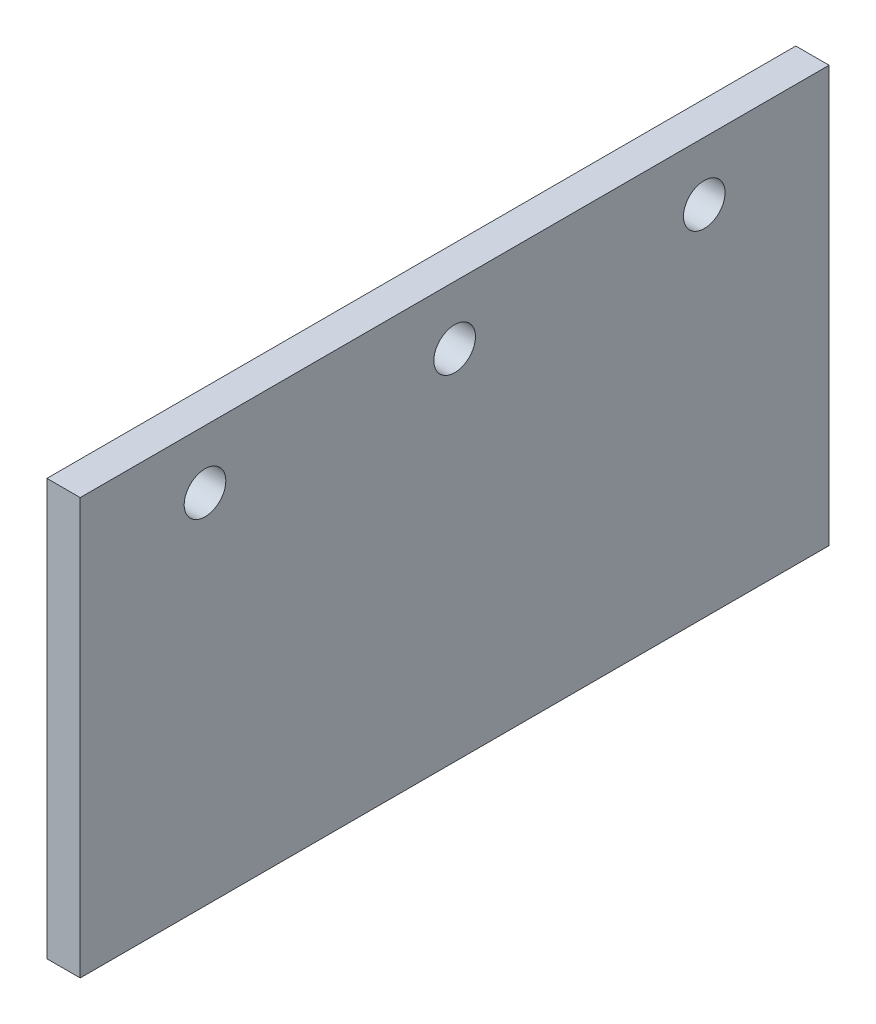
from build123d import *

# Parameters (mm, degrees)
SKETCH1_W               = 90
SKETCH1_H               = 50
BOSS_EXTRUDE1_DEPTH     = 4
CUT_EXTRUDE1_DEPTH      = 104.033974979
CUT_EXTRUDE1_DEPTH_BACK = 104.033974979
SKETCH2_R               = 2.5


with BuildPart() as part:
    # Sketch1 → Boss-Extrude1 (new body)
    with BuildSketch(Plane(origin=(0, 0, 0), x_dir=(0, 0, -1), z_dir=(1, 0, 0))):
        with Locations((45, -25)):
            Rectangle(SKETCH1_W, SKETCH1_H)
    extrude(amount=BOSS_EXTRUDE1_DEPTH)

    # Sketch2 → Cut-Extrude1 (cut, two sides: drawn at the far end of the back side and taken through both)
    with BuildSketch(Plane(origin=(4, 0, 0), x_dir=(0, 0, -1), z_dir=(1, 0, 0)).offset(-CUT_EXTRUDE1_DEPTH_BACK)):
        with Locations((15, -7)):
            Circle(SKETCH2_R)
        with Locations((45, -7)):
            Circle(SKETCH2_R)
        with Locations((75, -7)):
            Circle(SKETCH2_R)
    extrude(amount=CUT_EXTRUDE1_DEPTH + CUT_EXTRUDE1_DEPTH_BACK, mode=Mode.SUBTRACT)


solid = part.part
